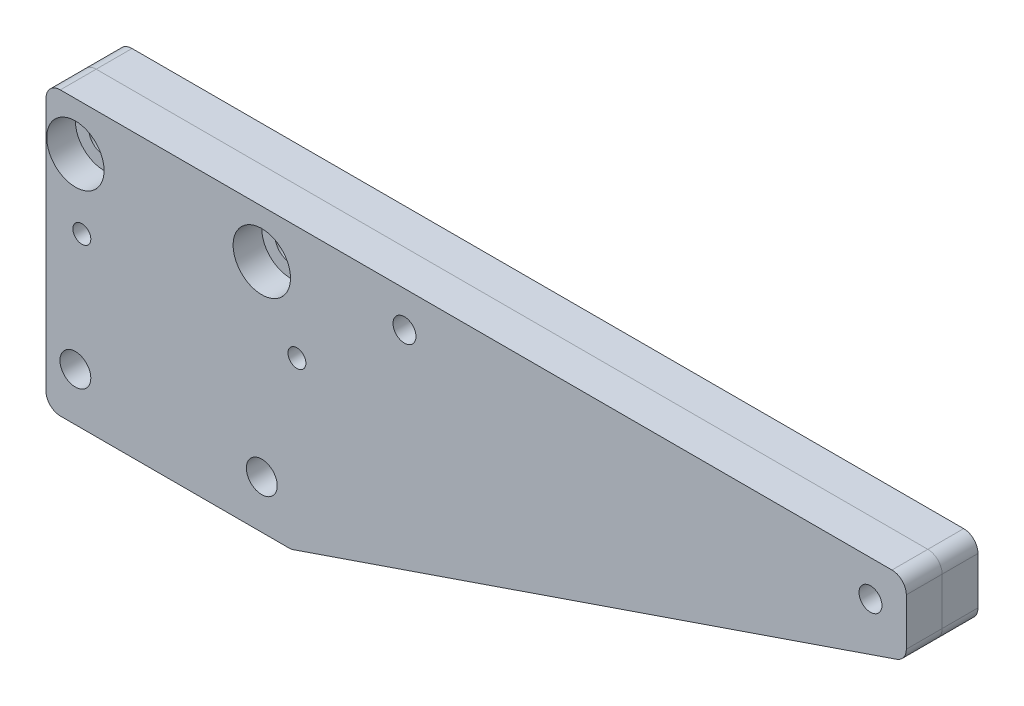
from build123d import *

# Parameters (mm, degrees)
BOSS_EXTRUDE1_DEPTH            = 5
CBORE_FOR_M4_SHCS1_D           = 4.3
CBORE_FOR_M4_SHCS1_CBORE_D     = 8
CBORE_FOR_M4_SHCS1_CBORE_DEPTH = 4
M4_CLEARANCE_HOLE1_D           = 4.3
TAP_DRILL_FOR_M3X0_5_TAP1_D    = 2.5
M3_CLEARANCE_HOLE2_D           = 3.2
FILLET1_R                      = 2


with BuildPart() as part:
    # Sketch1 → Boss-Extrude1 (new body)
    with BuildSketch(Plane.XY):
        Polygon((17.1, 19.7), (102.9, 19.7), (102.9, 9.7), (17.1, -19.7), (-17.1, -19.7), (-17.1, 19.7), align=None)
    extrude(amount=BOSS_EXTRUDE1_DEPTH)

    # CBORE for M4 SHCS1 (through all)
    with Locations(Plane.XY.offset(5)):
        with Locations((13, 13), (-13, 13)):
            CounterBoreHole(CBORE_FOR_M4_SHCS1_D / 2, CBORE_FOR_M4_SHCS1_CBORE_D / 2, CBORE_FOR_M4_SHCS1_CBORE_DEPTH)

    # M4 Clearance Hole1 (through all)
    with Locations(Plane.XY.offset(5)):
        with Locations((-13, -13), (13, -13)):
            Hole(M4_CLEARANCE_HOLE1_D / 2)

    # Tap Drill for M3x0.5 Tap1 (through all)
    with Locations(Plane.XY.offset(5)):
        with Locations((-12.1, 3.8), (17.9, 3.8)):
            Hole(TAP_DRILL_FOR_M3X0_5_TAP1_D / 2)

    # M3 Clearance Hole2 (through all)
    with Locations(Plane(origin=(0, 0, 0), x_dir=(-1, 0, 0), z_dir=(0, 0, -1))):
        with Locations((-97.9, 14.7), (-32.9, 14.7)):
            Hole(M3_CLEARANCE_HOLE2_D / 2)

    # Fillet1
    fillet1_edges = [part.edges().sort_by_distance(p)[0] for p in [
        (-17.1, 19.7, 2.5),
        (102.9, 19.7, 2.5),
        (102.9, 9.7, 2.5),
        (17.1, -19.7, 2.5),
        (-17.1, -19.7, 2.5),
    ]]
    fillet(fillet1_edges, radius=FILLET1_R)


with BuildPart() as body_2:
    # Mirror1: mirrored copy
    add(part.part.mirror(Plane.XY))


solid = Compound([part.part, body_2.part])
